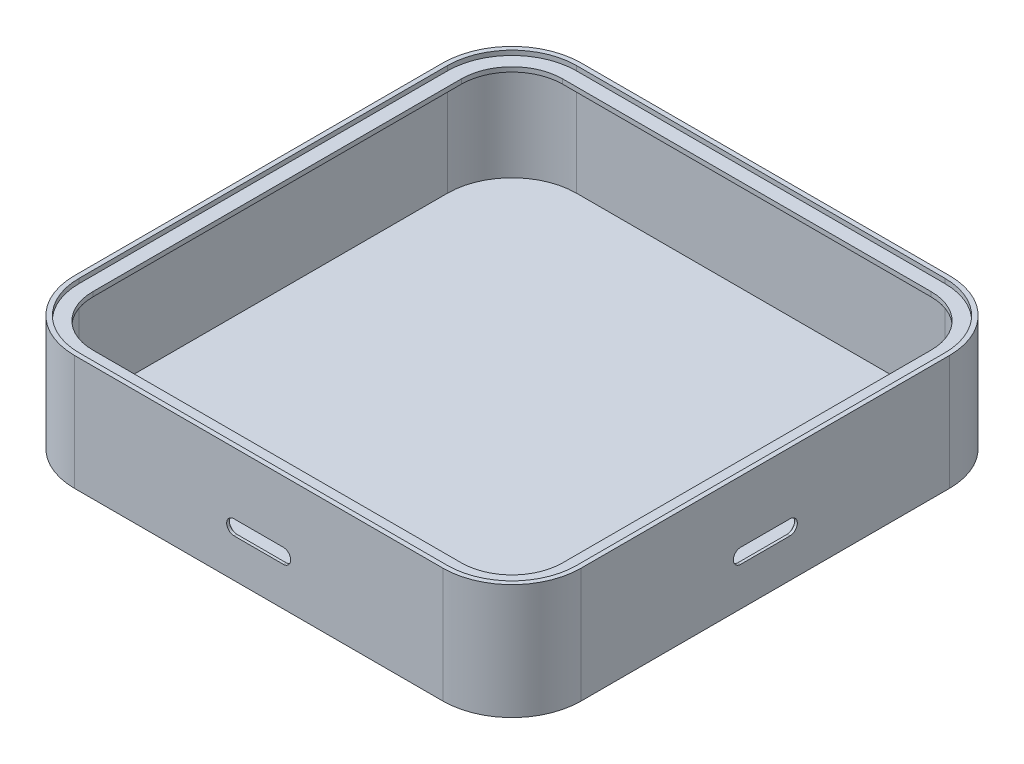
from build123d import *

# Parameters (mm, degrees)
BOSS_EXTRUDE1_DEPTH = 50
SHELL1_T            = -2
CUT_EXTRUDE2_DEPTH  = 5
CUT_EXTRUDE4_DEPTH  = 5
BOSS_EXTRUDE3_START = 44
BOSS_EXTRUDE3_DEPTH = 2
CUT_EXTRUDE6_REACH  = 254.198
CUT_EXTRUDE6_START  = -1.2
CUT_EXTRUDE7_REACH  = 254.198
CUT_EXTRUDE7_START  = -1.2


with BuildPart() as part:
    # Sketch1 → Boss-Extrude1 (new body)
    with BuildSketch(Plane(origin=(0, 0, 0), x_dir=(1, 0, 0), z_dir=(0, 1, 0))):
        with BuildLine():
            Line((-80, -110), (80, -110))
            ThreePointArc((80, -110), (101.213203436, -101.213203436), (110, -80))
            Line((110, -80), (110, 80))
            ThreePointArc((110, 80), (101.213203436, 101.213203436), (80, 110))
            Line((80, 110), (-80, 110))
            ThreePointArc((-80, 110), (-101.213203436, 101.213203436), (-110, 80))
            Line((-110, 80), (-110, -80))
            ThreePointArc((-110, -80), (-101.213203436, -101.213203436), (-80, -110))
        make_face()
    extrude(amount=BOSS_EXTRUDE1_DEPTH)

    # Shell1
    shell1_openings = [part.faces().sort_by_distance(p)[0] for p in [
        (0, 50, 0),
    ]]
    offset(amount=SHELL1_T, openings=shell1_openings, kind=Kind.INTERSECTION)

    # Sketch5 → Cut-Extrude2 (cut)
    with BuildSketch(Plane(origin=(110, 0, 0), x_dir=(0, 0, -1), z_dir=(1, 0, 0))):
        with BuildLine():
            Line((10.7, 23.2), (-10.7, 23.2))
            ThreePointArc((-10.7, 23.2), (-13.9, 20), (-10.7, 16.8))
            Line((-10.7, 16.8), (10.7, 16.8))
            ThreePointArc((10.7, 16.8), (13.9, 20), (10.7, 23.2))
        make_face()
    extrude(amount=-CUT_EXTRUDE2_DEPTH, mode=Mode.SUBTRACT)

    # Sketch7 → Cut-Extrude4 (cut)
    with BuildSketch(Plane.XY.offset(110)):
        with BuildLine():
            Line((10.7, 23.2), (-10.7, 23.2))
            ThreePointArc((-10.7, 23.2), (-13.9, 20), (-10.7, 16.8))
            Line((-10.7, 16.8), (10.7, 16.8))
            ThreePointArc((10.7, 16.8), (13.9, 20), (10.7, 23.2))
        make_face()
    extrude(amount=-CUT_EXTRUDE4_DEPTH, mode=Mode.SUBTRACT)

    # Sketch8 → Boss-Extrude3 (add)
    with BuildSketch(Plane(origin=(0, 2, 0), x_dir=(1, 0, 0), z_dir=(0, 1, 0)).offset(BOSS_EXTRUDE3_START)):
        with BuildLine():
            Line((80, 108), (-80, 108))
            ThreePointArc((-80, 108), (-99.798989873, 99.798989873), (-108, 80))
            Line((-108, 80), (-108, -80))
            ThreePointArc((-108, -80), (-99.798989873, -99.798989873), (-80, -108))
            Line((-80, -108), (80, -108))
            ThreePointArc((80, -108), (99.798989873, -99.798989873), (108, -80))
            Line((108, -80), (108, 80))
            ThreePointArc((108, 80), (99.798989873, 99.798989873), (80, 108))
        make_face()
        with BuildLine():
            Line((-102, 80), (-102, -80))
            ThreePointArc((-102, -80), (-95.556349186, -95.556349186), (-80, -102))
            Line((-80, -102), (80, -102))
            ThreePointArc((80, -102), (95.556349186, -95.556349186), (102, -80))
            Line((102, -80), (102, 80))
            ThreePointArc((102, 80), (95.556349186, 95.556349186), (80, 102))
            Line((80, 102), (-80, 102))
            ThreePointArc((-80, 102), (-95.556349186, 95.556349186), (-102, 80))
        make_face(mode=Mode.SUBTRACT)
    extrude(amount=BOSS_EXTRUDE3_DEPTH)

    # Sketch5<5> → Cut-Extrude6 (cut, up to next)
    with BuildSketch(Plane(origin=(110, 0, 0), x_dir=(0, 0, -1), z_dir=(1, 0, 0)).offset(CUT_EXTRUDE6_START), mode=Mode.PRIVATE) as cut_extrude6_sk1:
        with BuildLine():
            Line((-10.7, 24.2), (10.7, 24.2))
            ThreePointArc((10.7, 24.2), (14.9, 20), (10.7, 15.8))
            Line((10.7, 15.8), (-10.7, 15.8))
            ThreePointArc((-10.7, 15.8), (-14.9, 20), (-10.7, 24.2))
        make_face()
        with BuildLine():
            Line((-10.7, 23.2), (10.7, 23.2))
            ThreePointArc((10.7, 23.2), (13.9, 20), (10.7, 16.8))
            Line((10.7, 16.8), (-10.7, 16.8))
            ThreePointArc((-10.7, 16.8), (-13.9, 20), (-10.7, 23.2))
        make_face(mode=Mode.SUBTRACT)
    cut_extrude6_tool1 = extrude(cut_extrude6_sk1.sketch, amount=-CUT_EXTRUDE6_REACH, mode=Mode.PRIVATE) & part.part
    add(cut_extrude6_tool1.solids().sort_by_distance((108.8, 20, 14.590387))[0], mode=Mode.SUBTRACT)

    # Sketch7<3> → Cut-Extrude7 (cut, up to next)
    with BuildSketch(Plane.XY.offset(110).offset(CUT_EXTRUDE7_START), mode=Mode.PRIVATE) as cut_extrude7_sk1:
        with BuildLine():
            Line((-10.7, 24.2), (10.7, 24.2))
            ThreePointArc((10.7, 24.2), (14.9, 20), (10.7, 15.8))
            Line((10.7, 15.8), (-10.7, 15.8))
            ThreePointArc((-10.7, 15.8), (-14.9, 20), (-10.7, 24.2))
        make_face()
        with BuildLine():
            Line((-10.7, 23.2), (10.7, 23.2))
            ThreePointArc((10.7, 23.2), (13.9, 20), (10.7, 16.8))
            Line((10.7, 16.8), (-10.7, 16.8))
            ThreePointArc((-10.7, 16.8), (-13.9, 20), (-10.7, 23.2))
        make_face(mode=Mode.SUBTRACT)
    cut_extrude7_tool1 = extrude(cut_extrude7_sk1.sketch, amount=-CUT_EXTRUDE7_REACH, mode=Mode.PRIVATE) & part.part
    add(cut_extrude7_tool1.solids().sort_by_distance((0, 23.890387, 108.8))[0], mode=Mode.SUBTRACT)


solid = part.part
